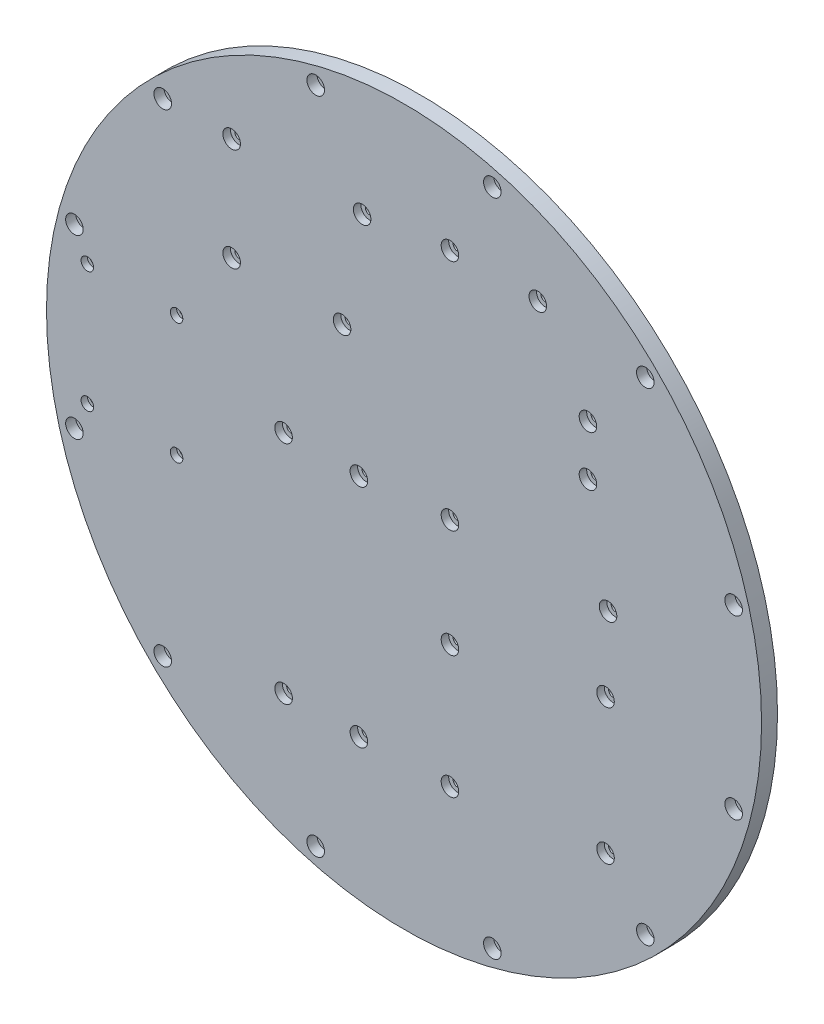
from build123d import *

# Parameters (mm, degrees)
ESQUISSE1_R              = 142.5
ESQUISSE1_R_2            = 1.75
BOSS_EXTRU_1_DEPTH       = 6.35
ESQUISSE2_R              = 3.5
ENL_V_MAT_EXTRU_1_DEPTH  = 4
ENL_V_MAT_EXTRU_2_REACH  = 203.625
ESQUISSE3_R              = 1.25
ESQUISSE4_R              = 2.5
ENL_V_MAT_EXTRU_3_DEPTH  = 2.5
ENL_V_MAT_EXTRU_4_REACH  = 203.625
ESQUISSE5_R              = 1.75
ESQUISSE6_R              = 3.5
ENL_V_MAT_EXTRU_5_DEPTH  = 3
ENL_V_MAT_EXTRU_6_REACH  = 203.625
ESQUISSE7_R              = 1.75
ESQUISSE8_R              = 3.5
ENL_V_MAT_EXTRU_7_DEPTH  = 3
ENL_V_MAT_EXTRU_8_REACH  = 203.625
ESQUISSE9_R              = 1.75
ESQUISSE10_R             = 3.5
ENL_V_MAT_EXTRU_9_DEPTH  = 3
ENL_V_MAT_EXTRU_10_REACH = 203.625
ESQUISSE11_R             = 1.75
ESQUISSE12_R             = 3.5
ENL_V_MAT_EXTRU_11_DEPTH = 3


with BuildPart() as part:
    # Esquisse1 → Boss.-Extru.1 (new body)
    with BuildSketch(Plane.XY):
        Circle(ESQUISSE1_R)
        with Locations((-35.199390134, 131.365912375)):
            Circle(ESQUISSE1_R_2, mode=Mode.SUBTRACT)
        with Locations((35.199390134, 131.365912375)):
            Circle(ESQUISSE1_R_2, mode=Mode.SUBTRACT)
        with Locations((96.166522241, 96.166522241)):
            Circle(ESQUISSE1_R_2, mode=Mode.SUBTRACT)
        with Locations((131.365912375, 35.199390134)):
            Circle(ESQUISSE1_R_2, mode=Mode.SUBTRACT)
        with Locations((131.365912375, -35.199390134)):
            Circle(ESQUISSE1_R_2, mode=Mode.SUBTRACT)
        with Locations((96.166522241, -96.166522241)):
            Circle(ESQUISSE1_R_2, mode=Mode.SUBTRACT)
        with Locations((35.199390134, -131.365912375)):
            Circle(ESQUISSE1_R_2, mode=Mode.SUBTRACT)
        with Locations((-35.199390134, -131.365912375)):
            Circle(ESQUISSE1_R_2, mode=Mode.SUBTRACT)
        with Locations((-96.166522241, -96.166522241)):
            Circle(ESQUISSE1_R_2, mode=Mode.SUBTRACT)
        with Locations((-131.365912375, -35.199390134)):
            Circle(ESQUISSE1_R_2, mode=Mode.SUBTRACT)
        with Locations((-131.365912375, 35.199390134)):
            Circle(ESQUISSE1_R_2, mode=Mode.SUBTRACT)
        with Locations((-96.166522241, 96.166522241)):
            Circle(ESQUISSE1_R_2, mode=Mode.SUBTRACT)
    extrude(amount=BOSS_EXTRU_1_DEPTH)

    # Esquisse2 → Enlèv. mat.-Extru.1 (cut)
    with BuildSketch(Plane.XY.offset(6.35)):
        with Locations((35.199390134, 131.365912375)):
            Circle(ESQUISSE2_R)
        with Locations((96.166522241, 96.166522241)):
            Circle(ESQUISSE2_R)
        with Locations((131.365912375, 35.199390134)):
            Circle(ESQUISSE2_R)
        with Locations((131.365912375, -35.199390134)):
            Circle(ESQUISSE2_R)
        with Locations((96.166522241, -96.166522241)):
            Circle(ESQUISSE2_R)
        with Locations((35.199390134, -131.365912375)):
            Circle(ESQUISSE2_R)
        with Locations((-35.199390134, -131.365912375)):
            Circle(ESQUISSE2_R)
        with Locations((-96.166522241, -96.166522241)):
            Circle(ESQUISSE2_R)
        with Locations((-131.365912375, -35.199390134)):
            Circle(ESQUISSE2_R)
        with Locations((-131.365912375, 35.199390134)):
            Circle(ESQUISSE2_R)
        with Locations((-96.166522241, 96.166522241)):
            Circle(ESQUISSE2_R)
        with Locations((-35.199390134, 131.365912375)):
            Circle(ESQUISSE2_R)
    extrude(amount=-ENL_V_MAT_EXTRU_1_DEPTH, mode=Mode.SUBTRACT)

    # Esquisse3 → Enlèv. mat.-Extru.2 (cut, up to next)
    with BuildSketch(Plane.XY.offset(6.35), mode=Mode.PRIVATE) as enl_v_mat_extru_2_sk1:
        with Locations((-126.214076473, -24.13)):
            Circle(ESQUISSE3_R)
    enl_v_mat_extru_2_tool1 = extrude(enl_v_mat_extru_2_sk1.sketch, amount=-ENL_V_MAT_EXTRU_2_REACH, mode=Mode.PRIVATE) & part.part
    # Esquisse3 → Enlèv. mat.-Extru.2 (cut, up to next)
    with BuildSketch(Plane.XY.offset(6.35), mode=Mode.PRIVATE) as enl_v_mat_extru_2_sk2:
        with Locations((-126.214076473, 24.13)):
            Circle(ESQUISSE3_R)
    enl_v_mat_extru_2_tool2 = extrude(enl_v_mat_extru_2_sk2.sketch, amount=-ENL_V_MAT_EXTRU_2_REACH, mode=Mode.PRIVATE) & part.part
    # Esquisse3 → Enlèv. mat.-Extru.2 (cut, up to next)
    with BuildSketch(Plane.XY.offset(6.35), mode=Mode.PRIVATE) as enl_v_mat_extru_2_sk3:
        with Locations((-90.654076473, 24.13)):
            Circle(ESQUISSE3_R)
    enl_v_mat_extru_2_tool3 = extrude(enl_v_mat_extru_2_sk3.sketch, amount=-ENL_V_MAT_EXTRU_2_REACH, mode=Mode.PRIVATE) & part.part
    # Esquisse3 → Enlèv. mat.-Extru.2 (cut, up to next)
    with BuildSketch(Plane.XY.offset(6.35), mode=Mode.PRIVATE) as enl_v_mat_extru_2_sk4:
        with Locations((-90.654076473, -24.13)):
            Circle(ESQUISSE3_R)
    enl_v_mat_extru_2_tool4 = extrude(enl_v_mat_extru_2_sk4.sketch, amount=-ENL_V_MAT_EXTRU_2_REACH, mode=Mode.PRIVATE) & part.part
    add(enl_v_mat_extru_2_tool1.solids().sort_by_distance((-126.214076, -24.13, 6.35))[0], mode=Mode.SUBTRACT)
    add(enl_v_mat_extru_2_tool2.solids().sort_by_distance((-126.214076, 24.13, 6.35))[0], mode=Mode.SUBTRACT)
    add(enl_v_mat_extru_2_tool3.solids().sort_by_distance((-90.654076, 24.13, 6.35))[0], mode=Mode.SUBTRACT)
    add(enl_v_mat_extru_2_tool4.solids().sort_by_distance((-90.654076, -24.13, 6.35))[0], mode=Mode.SUBTRACT)

    # Esquisse4 → Enlèv. mat.-Extru.3 (cut)
    with BuildSketch(Plane.XY.offset(6.35)):
        with Locations((-126.214076473, -24.13)):
            Circle(ESQUISSE4_R)
        with Locations((-126.214076473, 24.13)):
            Circle(ESQUISSE4_R)
        with Locations((-90.654076473, 24.13)):
            Circle(ESQUISSE4_R)
        with Locations((-90.654076473, -24.13)):
            Circle(ESQUISSE4_R)
    extrude(amount=-ENL_V_MAT_EXTRU_3_DEPTH, mode=Mode.SUBTRACT)

    # Esquisse5 → Enlèv. mat.-Extru.4 (cut, up to next)
    with BuildSketch(Plane.XY.offset(6.35), mode=Mode.PRIVATE) as enl_v_mat_extru_4_sk1:
        with Locations((-48, -85)):
            Circle(ESQUISSE5_R)
    enl_v_mat_extru_4_tool1 = extrude(enl_v_mat_extru_4_sk1.sketch, amount=-ENL_V_MAT_EXTRU_4_REACH, mode=Mode.PRIVATE) & part.part
    # Esquisse5 → Enlèv. mat.-Extru.4 (cut, up to next)
    with BuildSketch(Plane.XY.offset(6.35), mode=Mode.PRIVATE) as enl_v_mat_extru_4_sk2:
        with Locations((-48, 5)):
            Circle(ESQUISSE5_R)
    enl_v_mat_extru_4_tool2 = extrude(enl_v_mat_extru_4_sk2.sketch, amount=-ENL_V_MAT_EXTRU_4_REACH, mode=Mode.PRIVATE) & part.part
    # Esquisse5 → Enlèv. mat.-Extru.4 (cut, up to next)
    with BuildSketch(Plane.XY.offset(6.35), mode=Mode.PRIVATE) as enl_v_mat_extru_4_sk3:
        with Locations((-18, 5)):
            Circle(ESQUISSE5_R)
    enl_v_mat_extru_4_tool3 = extrude(enl_v_mat_extru_4_sk3.sketch, amount=-ENL_V_MAT_EXTRU_4_REACH, mode=Mode.PRIVATE) & part.part
    # Esquisse5 → Enlèv. mat.-Extru.4 (cut, up to next)
    with BuildSketch(Plane.XY.offset(6.35), mode=Mode.PRIVATE) as enl_v_mat_extru_4_sk4:
        with Locations((-18, -85)):
            Circle(ESQUISSE5_R)
    enl_v_mat_extru_4_tool4 = extrude(enl_v_mat_extru_4_sk4.sketch, amount=-ENL_V_MAT_EXTRU_4_REACH, mode=Mode.PRIVATE) & part.part
    add(enl_v_mat_extru_4_tool1.solids().sort_by_distance((-48, -85, 6.35))[0], mode=Mode.SUBTRACT)
    add(enl_v_mat_extru_4_tool2.solids().sort_by_distance((-48, 5, 6.35))[0], mode=Mode.SUBTRACT)
    add(enl_v_mat_extru_4_tool3.solids().sort_by_distance((-18, 5, 6.35))[0], mode=Mode.SUBTRACT)
    add(enl_v_mat_extru_4_tool4.solids().sort_by_distance((-18, -85, 6.35))[0], mode=Mode.SUBTRACT)

    # Esquisse6 → Enlèv. mat.-Extru.5 (cut)
    with BuildSketch(Plane.XY.offset(6.35)):
        with Locations((-48, -85)):
            Circle(ESQUISSE6_R)
        with Locations((-18, -85)):
            Circle(ESQUISSE6_R)
        with Locations((-48, 5)):
            Circle(ESQUISSE6_R)
        with Locations((-18, 5)):
            Circle(ESQUISSE6_R)
    extrude(amount=-ENL_V_MAT_EXTRU_5_DEPTH, mode=Mode.SUBTRACT)

    # Esquisse7 → Enlèv. mat.-Extru.6 (cut, up to next)
    with BuildSketch(Plane.XY.offset(6.35), mode=Mode.PRIVATE) as enl_v_mat_extru_6_sk1:
        with Locations((-68.7, 55)):
            Circle(ESQUISSE7_R)
    enl_v_mat_extru_6_tool1 = extrude(enl_v_mat_extru_6_sk1.sketch, amount=-ENL_V_MAT_EXTRU_6_REACH, mode=Mode.PRIVATE) & part.part
    # Esquisse7 → Enlèv. mat.-Extru.6 (cut, up to next)
    with BuildSketch(Plane.XY.offset(6.35), mode=Mode.PRIVATE) as enl_v_mat_extru_6_sk2:
        with Locations((-68.7, 96)):
            Circle(ESQUISSE7_R)
    enl_v_mat_extru_6_tool2 = extrude(enl_v_mat_extru_6_sk2.sketch, amount=-ENL_V_MAT_EXTRU_6_REACH, mode=Mode.PRIVATE) & part.part
    # Esquisse7 → Enlèv. mat.-Extru.6 (cut, up to next)
    with BuildSketch(Plane.XY.offset(6.35), mode=Mode.PRIVATE) as enl_v_mat_extru_6_sk3:
        with Locations((-24.7, 54)):
            Circle(ESQUISSE7_R)
    enl_v_mat_extru_6_tool3 = extrude(enl_v_mat_extru_6_sk3.sketch, amount=-ENL_V_MAT_EXTRU_6_REACH, mode=Mode.PRIVATE) & part.part
    # Esquisse7 → Enlèv. mat.-Extru.6 (cut, up to next)
    with BuildSketch(Plane.XY.offset(6.35), mode=Mode.PRIVATE) as enl_v_mat_extru_6_sk4:
        with Locations((-16.7, 96)):
            Circle(ESQUISSE7_R)
    enl_v_mat_extru_6_tool4 = extrude(enl_v_mat_extru_6_sk4.sketch, amount=-ENL_V_MAT_EXTRU_6_REACH, mode=Mode.PRIVATE) & part.part
    add(enl_v_mat_extru_6_tool1.solids().sort_by_distance((-68.7, 55, 6.35))[0], mode=Mode.SUBTRACT)
    add(enl_v_mat_extru_6_tool2.solids().sort_by_distance((-68.7, 96, 6.35))[0], mode=Mode.SUBTRACT)
    add(enl_v_mat_extru_6_tool3.solids().sort_by_distance((-24.7, 54, 6.35))[0], mode=Mode.SUBTRACT)
    add(enl_v_mat_extru_6_tool4.solids().sort_by_distance((-16.7, 96, 6.35))[0], mode=Mode.SUBTRACT)

    # Esquisse8 → Enlèv. mat.-Extru.7 (cut)
    with BuildSketch(Plane.XY.offset(6.35)):
        with Locations((-68.7, 55)):
            Circle(ESQUISSE8_R)
        with Locations((-68.7, 96)):
            Circle(ESQUISSE8_R)
        with Locations((-24.7, 54)):
            Circle(ESQUISSE8_R)
        with Locations((-16.7, 96)):
            Circle(ESQUISSE8_R)
    extrude(amount=-ENL_V_MAT_EXTRU_7_DEPTH, mode=Mode.SUBTRACT)

    # Esquisse9 → Enlèv. mat.-Extru.8 (cut, up to next)
    with BuildSketch(Plane(origin=(0, 0, 6.35), x_dir=(-1, 0, 0), z_dir=(0, 0, -1)), mode=Mode.PRIVATE) as enl_v_mat_extru_8_sk1:
        with Locations(Location((-18.3, 101, 0), (0, 0, 180))):
            Circle(ESQUISSE9_R)
    enl_v_mat_extru_8_tool1 = extrude(enl_v_mat_extru_8_sk1.sketch, amount=ENL_V_MAT_EXTRU_8_REACH, mode=Mode.PRIVATE) & part.part
    # Esquisse9 → Enlèv. mat.-Extru.8 (cut, up to next)
    with BuildSketch(Plane(origin=(0, 0, 6.35), x_dir=(-1, 0, 0), z_dir=(0, 0, -1)), mode=Mode.PRIVATE) as enl_v_mat_extru_8_sk2:
        with Locations(Location((-18.3, 8, 0), (0, 0, 180))):
            Circle(ESQUISSE9_R)
    enl_v_mat_extru_8_tool2 = extrude(enl_v_mat_extru_8_sk2.sketch, amount=ENL_V_MAT_EXTRU_8_REACH, mode=Mode.PRIVATE) & part.part
    # Esquisse9 → Enlèv. mat.-Extru.8 (cut, up to next)
    with BuildSketch(Plane(origin=(0, 0, 6.35), x_dir=(-1, 0, 0), z_dir=(0, 0, -1)), mode=Mode.PRIVATE) as enl_v_mat_extru_8_sk3:
        with Locations(Location((-53.3, 101, 0), (0, 0, 180))):
            Circle(ESQUISSE9_R)
    enl_v_mat_extru_8_tool3 = extrude(enl_v_mat_extru_8_sk3.sketch, amount=ENL_V_MAT_EXTRU_8_REACH, mode=Mode.PRIVATE) & part.part
    # Esquisse9 → Enlèv. mat.-Extru.8 (cut, up to next)
    with BuildSketch(Plane(origin=(0, 0, 6.35), x_dir=(-1, 0, 0), z_dir=(0, 0, -1)), mode=Mode.PRIVATE) as enl_v_mat_extru_8_sk4:
        with Locations(Location((-81.3, 8, 0), (0, 0, 180))):
            Circle(ESQUISSE9_R)
    enl_v_mat_extru_8_tool4 = extrude(enl_v_mat_extru_8_sk4.sketch, amount=ENL_V_MAT_EXTRU_8_REACH, mode=Mode.PRIVATE) & part.part
    # Esquisse9 → Enlèv. mat.-Extru.8 (cut, up to next)
    with BuildSketch(Plane(origin=(0, 0, 6.35), x_dir=(-1, 0, 0), z_dir=(0, 0, -1)), mode=Mode.PRIVATE) as enl_v_mat_extru_8_sk5:
        with Locations(Location((-73.3, 69.5, 0), (0, 0, 180))):
            Circle(ESQUISSE9_R)
    enl_v_mat_extru_8_tool5 = extrude(enl_v_mat_extru_8_sk5.sketch, amount=ENL_V_MAT_EXTRU_8_REACH, mode=Mode.PRIVATE) & part.part
    # Esquisse9 → Enlèv. mat.-Extru.8 (cut, up to next)
    with BuildSketch(Plane(origin=(0, 0, 6.35), x_dir=(-1, 0, 0), z_dir=(0, 0, -1)), mode=Mode.PRIVATE) as enl_v_mat_extru_8_sk6:
        with Locations(Location((-73.3, 49.5, 0), (0, 0, 180))):
            Circle(ESQUISSE9_R)
    enl_v_mat_extru_8_tool6 = extrude(enl_v_mat_extru_8_sk6.sketch, amount=ENL_V_MAT_EXTRU_8_REACH, mode=Mode.PRIVATE) & part.part
    add(enl_v_mat_extru_8_tool1.solids().sort_by_distance((18.3, 101, 6.35))[0], mode=Mode.SUBTRACT)
    add(enl_v_mat_extru_8_tool2.solids().sort_by_distance((18.3, 8, 6.35))[0], mode=Mode.SUBTRACT)
    add(enl_v_mat_extru_8_tool3.solids().sort_by_distance((53.3, 101, 6.35))[0], mode=Mode.SUBTRACT)
    add(enl_v_mat_extru_8_tool4.solids().sort_by_distance((81.3, 8, 6.35))[0], mode=Mode.SUBTRACT)
    add(enl_v_mat_extru_8_tool5.solids().sort_by_distance((73.3, 69.5, 6.35))[0], mode=Mode.SUBTRACT)
    add(enl_v_mat_extru_8_tool6.solids().sort_by_distance((73.3, 49.5, 6.35))[0], mode=Mode.SUBTRACT)

    # Esquisse10 → Enlèv. mat.-Extru.9 (cut)
    with BuildSketch(Plane.XY.offset(6.35)):
        with Locations((18.3, 8)):
            Circle(ESQUISSE10_R)
        with Locations((18.3, 101)):
            Circle(ESQUISSE10_R)
        with Locations((53.3, 101)):
            Circle(ESQUISSE10_R)
        with Locations((81.3, 8)):
            Circle(ESQUISSE10_R)
        with Locations((73.3, 69.5)):
            Circle(ESQUISSE10_R)
        with Locations((73.3, 49.5)):
            Circle(ESQUISSE10_R)
    extrude(amount=-ENL_V_MAT_EXTRU_9_DEPTH, mode=Mode.SUBTRACT)

    # Esquisse11 → Enlèv. mat.-Extru.10 (cut, up to next)
    with BuildSketch(Plane(origin=(0, 0, 6.35), x_dir=(-1, 0, 0), z_dir=(0, 0, -1)), mode=Mode.PRIVATE) as enl_v_mat_extru_10_sk1:
        with Locations(Location((-18.3, -35, 0), (0, 0, 180))):
            Circle(ESQUISSE11_R)
    enl_v_mat_extru_10_tool1 = extrude(enl_v_mat_extru_10_sk1.sketch, amount=ENL_V_MAT_EXTRU_10_REACH, mode=Mode.PRIVATE) & part.part
    # Esquisse11 → Enlèv. mat.-Extru.10 (cut, up to next)
    with BuildSketch(Plane(origin=(0, 0, 6.35), x_dir=(-1, 0, 0), z_dir=(0, 0, -1)), mode=Mode.PRIVATE) as enl_v_mat_extru_10_sk2:
        with Locations(Location((-18.3, -84, 0), (0, 0, 180))):
            Circle(ESQUISSE11_R)
    enl_v_mat_extru_10_tool2 = extrude(enl_v_mat_extru_10_sk2.sketch, amount=ENL_V_MAT_EXTRU_10_REACH, mode=Mode.PRIVATE) & part.part
    # Esquisse11 → Enlèv. mat.-Extru.10 (cut, up to next)
    with BuildSketch(Plane(origin=(0, 0, 6.35), x_dir=(-1, 0, 0), z_dir=(0, 0, -1)), mode=Mode.PRIVATE) as enl_v_mat_extru_10_sk3:
        with Locations(Location((-80.3, -22, 0), (0, 0, 180))):
            Circle(ESQUISSE11_R)
    enl_v_mat_extru_10_tool3 = extrude(enl_v_mat_extru_10_sk3.sketch, amount=ENL_V_MAT_EXTRU_10_REACH, mode=Mode.PRIVATE) & part.part
    # Esquisse11 → Enlèv. mat.-Extru.10 (cut, up to next)
    with BuildSketch(Plane(origin=(0, 0, 6.35), x_dir=(-1, 0, 0), z_dir=(0, 0, -1)), mode=Mode.PRIVATE) as enl_v_mat_extru_10_sk4:
        with Locations(Location((-80.3, -76, 0), (0, 0, 180))):
            Circle(ESQUISSE11_R)
    enl_v_mat_extru_10_tool4 = extrude(enl_v_mat_extru_10_sk4.sketch, amount=ENL_V_MAT_EXTRU_10_REACH, mode=Mode.PRIVATE) & part.part
    add(enl_v_mat_extru_10_tool1.solids().sort_by_distance((18.3, -35, 6.35))[0], mode=Mode.SUBTRACT)
    add(enl_v_mat_extru_10_tool2.solids().sort_by_distance((18.3, -84, 6.35))[0], mode=Mode.SUBTRACT)
    add(enl_v_mat_extru_10_tool3.solids().sort_by_distance((80.3, -22, 6.35))[0], mode=Mode.SUBTRACT)
    add(enl_v_mat_extru_10_tool4.solids().sort_by_distance((80.3, -76, 6.35))[0], mode=Mode.SUBTRACT)

    # Esquisse12 → Enlèv. mat.-Extru.11 (cut)
    with BuildSketch(Plane.XY.offset(6.35)):
        with Locations((18.3, -84)):
            Circle(ESQUISSE12_R)
        with Locations((18.3, -35)):
            Circle(ESQUISSE12_R)
        with Locations((80.3, -22)):
            Circle(ESQUISSE12_R)
        with Locations((80.3, -76)):
            Circle(ESQUISSE12_R)
    extrude(amount=-ENL_V_MAT_EXTRU_11_DEPTH, mode=Mode.SUBTRACT)


solid = part.part
